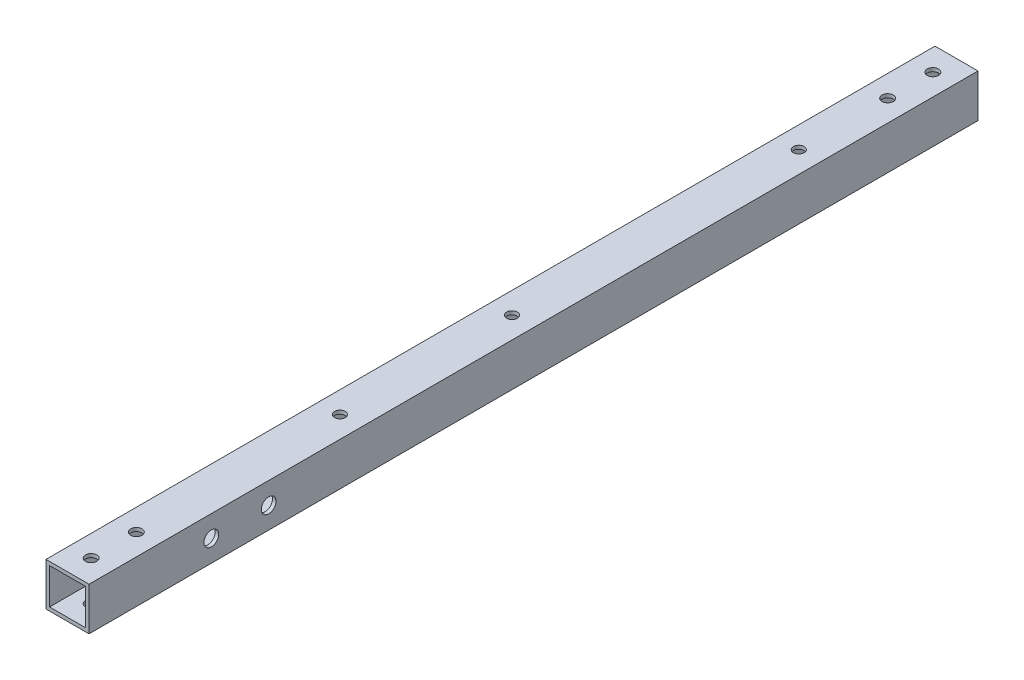
from build123d import *

# Parameters (mm, degrees)
SKETCH1_W           = 19.05
SKETCH1_H           = 19.05
SKETCH1_W_2         = 15.875
SKETCH1_H_2         = 15.875
BOSS_EXTRUDE1_DEPTH = 196.85
SKETCH2_R           = 2.5
CUT_EXTRUDE1_DEPTH  = 30
SKETCH3_R           = 3.2639
CUT_EXTRUDE2_DEPTH  = 30
SKETCH4_R           = 2.38125
CUT_EXTRUDE3_DEPTH  = 30


with BuildPart() as part:
    # Sketch1 → Boss-Extrude1 (new, symmetric)
    with BuildSketch(Plane.XY):
        Rectangle(SKETCH1_W, SKETCH1_H)
        Rectangle(SKETCH1_W_2, SKETCH1_H_2, mode=Mode.SUBTRACT)
    extrude(amount=BOSS_EXTRUDE1_DEPTH, both=True)

    # Sketch2 → Cut-Extrude1 (cut)
    with BuildSketch(Plane(origin=(0, 13.525, 0), x_dir=(1, 0, 0), z_dir=(0, 1, 0))):
        with Locations(Location((0, -186.375, 0), (0, 0, 270))):
            Circle(SKETCH2_R)
        with Locations(Location((0, -166.375, 0), (0, 0, 270))):
            Circle(SKETCH2_R)
    cut_extrude1 = extrude(amount=-CUT_EXTRUDE1_DEPTH, mode=Mode.SUBTRACT)

    # Mirror1: Cut-Extrude1 across Front Plane
    add(cut_extrude1.mirror(Plane.XY), mode=Mode.SUBTRACT)

    # Sketch3 → Cut-Extrude2 (cut)
    with BuildSketch(Plane.ZY.offset(14.3002)):
        with Locations(Location((142.675, 0, 0), (0, 0, 180))):
            Circle(SKETCH3_R)
        with Locations(Location((117.275, 0, 0), (0, 0, 180))):
            Circle(SKETCH3_R)
    extrude(amount=-CUT_EXTRUDE2_DEPTH, mode=Mode.SUBTRACT)

    # Sketch4 → Cut-Extrude3 (cut)
    with BuildSketch(Plane(origin=(0, 18.1864, 0), x_dir=(1, 0, 0), z_dir=(0, 1, 0))):
        with Locations(Location((0, 0, 0), (0, 0, 270))):
            Circle(SKETCH4_R)
        with Locations(Location((0, 127, 0), (0, 0, 270))):
            Circle(SKETCH4_R)
        with Locations(Location((0, -76.2, 0), (0, 0, 270))):
            Circle(SKETCH4_R)
    extrude(amount=-CUT_EXTRUDE3_DEPTH, mode=Mode.SUBTRACT)


solid = part.part
